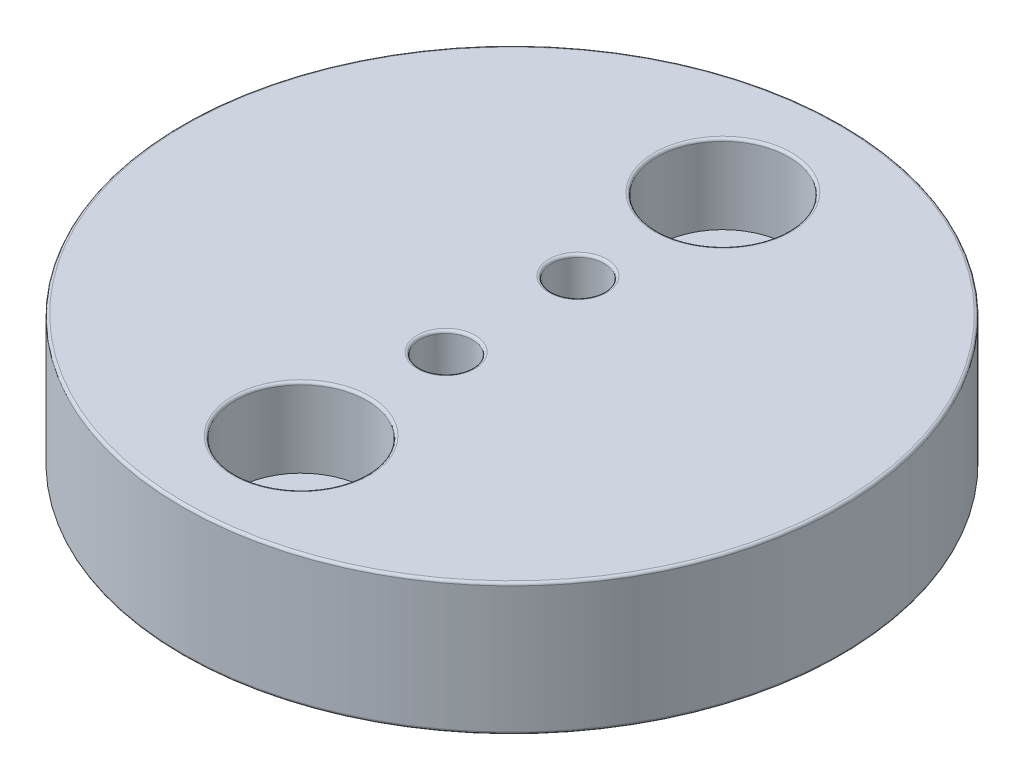
from build123d import *

# Parameters (mm, degrees)
SKETCH_1_R          = 12.5
SKETCH_1_R_2        = 1.25
EXTRUDE_1_DEPTH     = 5
CUT_EXTRUDE_1_REACH = 20.371
SKETCH_3_R          = 1
SKETCH_4_R          = 2.5
CUT_EXTRUDE_2_DEPTH = 3
SKETCH_5_R          = 1.65
CUT_EXTRUDE_3_DEPTH = 3.2
FILLET_1_R          = 0.1


with BuildPart() as part:
    # 草图1 → 凸台-拉伸1 (new body)
    with BuildSketch(Plane(origin=(0, 0, 0), x_dir=(1, 0, 0), z_dir=(0, 1, 0))):
        with Locations(Location((0, 0, 0), (0, 0, 270))):
            Circle(SKETCH_1_R)
        with Locations(Location((0, 8, 0), (0, 0, 270))):
            Circle(SKETCH_1_R_2, mode=Mode.SUBTRACT)
        with Locations(Location((0, -8, 0), (0, 0, 270))):
            Circle(SKETCH_1_R_2, mode=Mode.SUBTRACT)
    extrude(amount=EXTRUDE_1_DEPTH)

    # 草图3 → 切除-拉伸1 (cut, up to next)
    with BuildSketch(Plane(origin=(0, 5, 0), x_dir=(1, 0, 0), z_dir=(0, 1, 0)), mode=Mode.PRIVATE) as cut_extrude_1_sk1:
        with Locations(Location((0, 2.5, 0), (0, 0, 270))):
            Circle(SKETCH_3_R)
    cut_extrude_1_tool1 = extrude(cut_extrude_1_sk1.sketch, amount=-CUT_EXTRUDE_1_REACH, mode=Mode.PRIVATE) & part.part
    # 草图3 → 切除-拉伸1 (cut, up to next)
    with BuildSketch(Plane(origin=(0, 5, 0), x_dir=(1, 0, 0), z_dir=(0, 1, 0)), mode=Mode.PRIVATE) as cut_extrude_1_sk2:
        with Locations(Location((0, -2.5, 0), (0, 0, 270))):
            Circle(SKETCH_3_R)
    cut_extrude_1_tool2 = extrude(cut_extrude_1_sk2.sketch, amount=-CUT_EXTRUDE_1_REACH, mode=Mode.PRIVATE) & part.part
    add(cut_extrude_1_tool1.solids().sort_by_distance((0, 5, -2.5))[0], mode=Mode.SUBTRACT)
    add(cut_extrude_1_tool2.solids().sort_by_distance((0, 5, 2.5))[0], mode=Mode.SUBTRACT)

    # 草图4 → 切除-拉伸2 (cut)
    with BuildSketch(Plane(origin=(0, 5, 0), x_dir=(1, 0, 0), z_dir=(0, 1, 0))):
        with Locations(Location((0, 8, 0), (0, 0, 270))):
            Circle(SKETCH_4_R)
        with Locations(Location((0, -8, 0), (0, 0, 270))):
            Circle(SKETCH_4_R)
    extrude(amount=-CUT_EXTRUDE_2_DEPTH, mode=Mode.SUBTRACT)

    # 草图5 → 切除-拉伸3 (cut)
    with BuildSketch(Plane.XZ):
        with Locations(Location((0, 2.5, 0), (0, 0, 270))):
            Circle(SKETCH_5_R)
        with Locations(Location((0, -2.5, 0), (0, 0, 270))):
            Circle(SKETCH_5_R)
    extrude(amount=-CUT_EXTRUDE_3_DEPTH, mode=Mode.SUBTRACT)

    # 圆角1
    fillet_1_edges = [part.edges().sort_by_distance(p)[0] for p in [
        (0, 5, -3.5),
        (0, 5, 1.5),
        (0, 0, -12.5),
        (0, 2, -9.25),
        (0, 5, -10.5),
        (0, 2, 6.75),
        (0, 5, 5.5),
        (0, 0, 4.15),
        (0, 3.2, 1.5),
        (0, 0, -0.85),
        (0, 3.2, -3.5),
        (0, 5, -12.5),
        (0, 0, -9.25),
        (0, 0, 6.75),
    ]]
    fillet(fillet_1_edges, radius=FILLET_1_R)


solid = part.part
